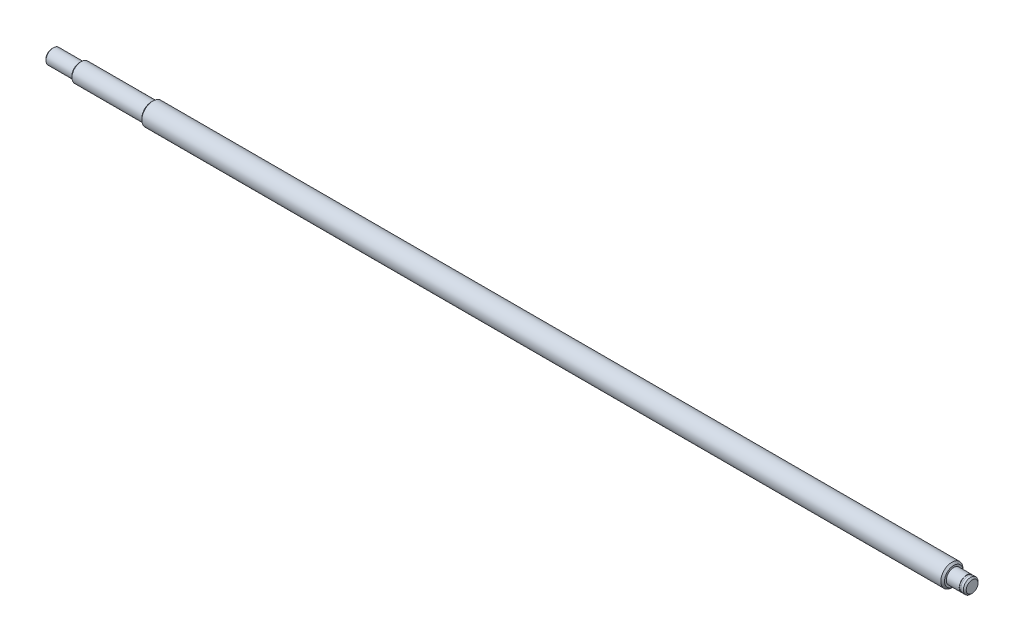
from build123d import *


with BuildPart() as part:
    # Esquisse1 → Révolution1 (revolve)
    with BuildSketch(Plane.XY, mode=Mode.PRIVATE) as r_volution1_sk:
        Polygon((-250, 0), (-250, 3.2), (-249.2, 4), (-235, 4), (-235, 4.1), (-234.1, 5), (-196, 5), (-196, 5.1), (-195.1, 6), (239, 6), (240, 5), (240, 4), (247, 4), (247, 3.8), (247.9, 3.8), (247.9, 4), (249.2, 4), (250, 3.2), (250, 0), align=None)
    revolve(r_volution1_sk.sketch.rotate(Axis((-511.970894611, 0, 0), (1, 0, 0)), 180), axis=Axis((-511.970894611, 0, 0), (1, 0, 0)))


solid = part.part
